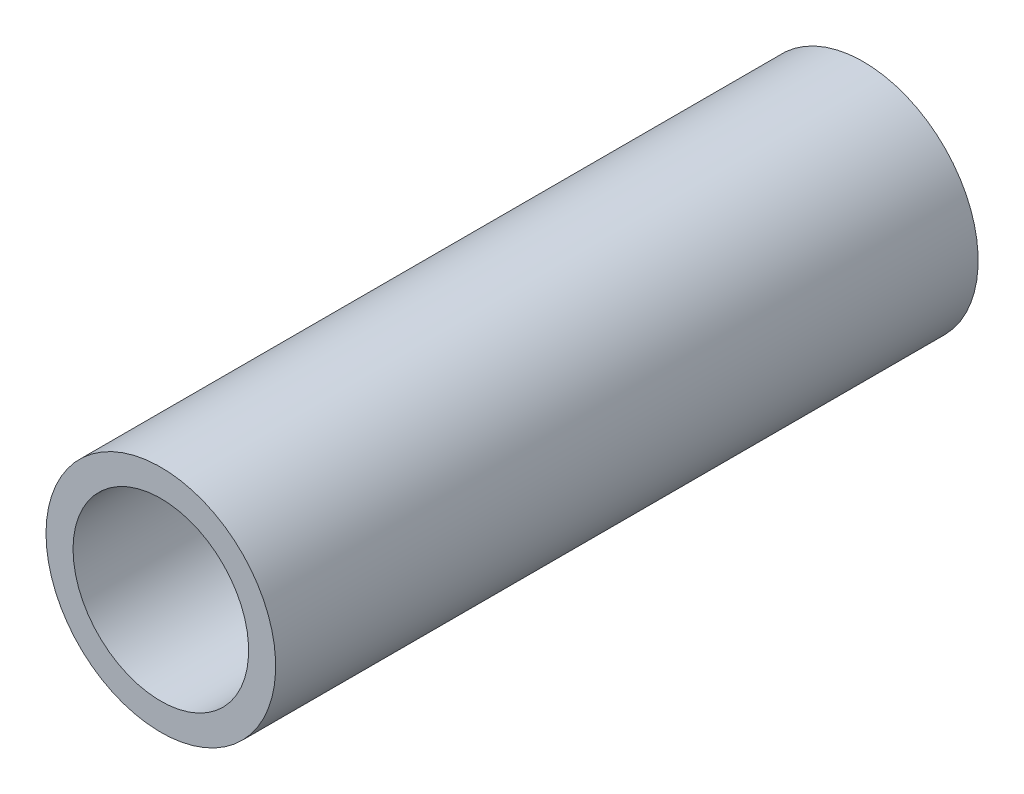
from build123d import *

# Parameters (mm, degrees)
SCHIZZO1_R                   = 4.25
SCHIZZO1_R_2                 = 3.25
ESTRUSIONE_ESTRUSIONE1_DEPTH = 26


with BuildPart() as part:
    # Schizzo1 → Estrusione-Estrusione1 (new body)
    with BuildSketch(Plane.XY):
        with Locations(Location((0, 0, 0), (0, 0, 180))):
            Circle(SCHIZZO1_R)
        with Locations(Location((0, 0, 0), (0, 0, 180))):
            Circle(SCHIZZO1_R_2, mode=Mode.SUBTRACT)
    extrude(amount=ESTRUSIONE_ESTRUSIONE1_DEPTH)


solid = part.part
